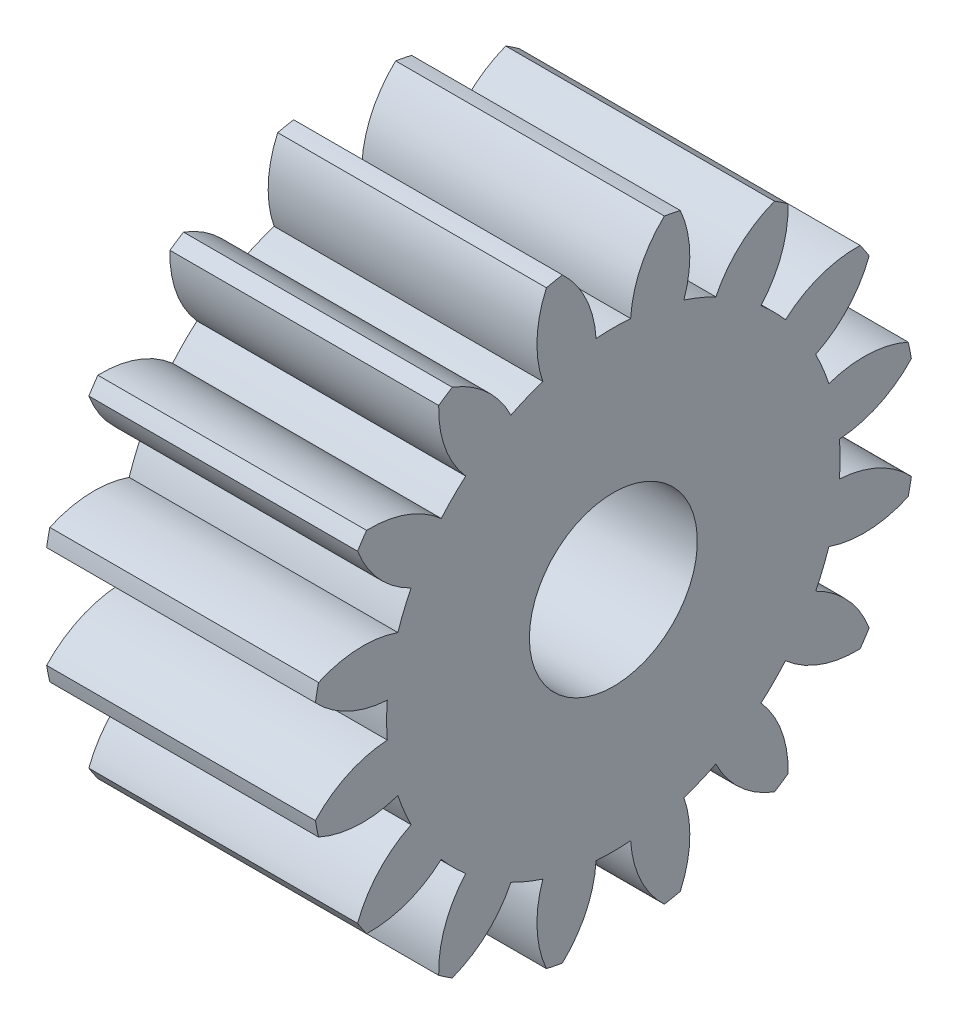
from build123d import *

# Parameters (mm, degrees)
BASPROSKE_W     = 32
BASPROSKE_H     = 36
TOOTHCUT_DEPTH  = 61.133185513
TEETHCUTS_COUNT = 16
TEETHCUTS_ANGLE = 337.5
BORSKE_R        = 10
BORE_DEPTH      = 50.0000508


with BuildPart() as part:
    # BasProSke → Base-Revolve (revolve)
    with BuildSketch(Plane(origin=(0, 0, 0), x_dir=(1, 0, 0), z_dir=(0, 1, 0)), mode=Mode.PRIVATE) as base_revolve_sk:
        with Locations((16, 18)):
            Rectangle(BASPROSKE_W, BASPROSKE_H)
    revolve(base_revolve_sk.sketch.rotate(Axis((-10, 0, 0), (1, 0, 0)), 180), axis=Axis((-10, 0, 0), (1, 0, 0)))

    # TooCutSke → ToothCut (cut, through all)
    with BuildSketch(Plane(origin=(0, 0, 0), x_dir=(0, 0, -1), z_dir=(1, 0, 0))):
        with BuildLine():
            ThreePointArc((2.058400171, 26.920419568), (0, 26.999), (-2.058400171, 26.920419568))
            ThreePointArc((-2.058400171, 26.920419568), (-3.251552006, 31.601017563), (-6.094319399, 35.506178564))
            ThreePointArc((-6.094319399, 35.506178564), (0, 36.0254), (6.094319399, 35.506178564))
            ThreePointArc((6.094319399, 35.506178564), (3.251552006, 31.601017563), (2.058400171, 26.920419568))
        make_face()
    toothcut = extrude(amount=TOOTHCUT_DEPTH, mode=Mode.SUBTRACT)

    # TeethCuts: ToothCut ×16 about axis
    teethcuts_axis = Axis((-10, 0, 0), (1, 0, 0))
    for i in range(1, TEETHCUTS_COUNT):
        add(toothcut.rotate(teethcuts_axis, i * TEETHCUTS_ANGLE / (TEETHCUTS_COUNT - 1)), mode=Mode.SUBTRACT)

    # BorSke → Bore (cut, symmetric)
    with BuildSketch(Plane(origin=(0, 0, 0), x_dir=(0, 0, -1), z_dir=(1, 0, 0))):
        with Locations(Location((0, 0, 0), (0, 0, 180))):
            Circle(BORSKE_R)
    extrude(amount=BORE_DEPTH, both=True, mode=Mode.SUBTRACT)


solid = part.part
